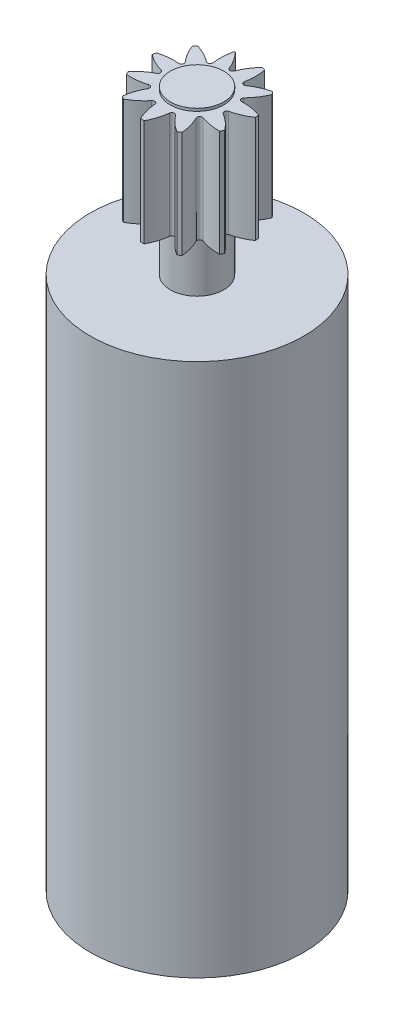
from build123d import *

# Parameters (mm, degrees)
CUT_EXTRUDE_START        = -4.3
CUT_EXTRUDE_1_DEPTH      = 4.3
PATTERN_CIRCULAR_1_COUNT = 11
PATTERN_CIRCULAR_1_ANGLE = 330


with BuildPart() as part:
    # ｽｹｯﾁ1 → 回転1 (revolve)
    with BuildSketch(Plane.XY, mode=Mode.PRIVATE) as revolve_1_sk:
        Polygon((0, 0), (0, 26.1), (1, 26.1), (1, 26), (2, 26), (2, 22), (1, 22), (1, 20), (4, 20), (4, 0), align=None)
    revolve(revolve_1_sk.sketch.rotate(Axis((0, 0, 0), (0, 1, 0)), 90), axis=Axis((0, 0, 0), (0, 1, 0)))

    # ｽｹｯﾁ3 → ｶｯﾄ - 押し出し1 (cut)
    with BuildSketch(Plane(origin=(0, 26, 0), x_dir=(1, 0, 0), z_dir=(0, 1, 0)).offset(CUT_EXTRUDE_START)):
        with BuildLine():
            ThreePointArc((0.092905413, 1.299949383), (0.266119458, 1.637619869), (0.5, 1.936491673))
            ThreePointArc((0.5, 1.936491673), (0, 2), (-0.5, 1.936491673))
            ThreePointArc((-0.5, 1.936491673), (-0.266119458, 1.637619869), (-0.092905413, 1.299949383))
            ThreePointArc((-0.092905413, 1.299949383), (0, 1.236943764), (0.092905413, 1.299949383))
        make_face()
    cut_extrude_1 = extrude(amount=CUT_EXTRUDE_1_DEPTH, mode=Mode.SUBTRACT)

    # 円形ﾊﾟﾀｰﾝ1: ｶｯﾄ - 押し出し1 ×11 about axis
    pattern_circular_1_axis = Axis((0, 0, 0), (0, -1, 0))
    for i in range(1, PATTERN_CIRCULAR_1_COUNT):
        add(cut_extrude_1.rotate(pattern_circular_1_axis, i * PATTERN_CIRCULAR_1_ANGLE / (PATTERN_CIRCULAR_1_COUNT - 1)), mode=Mode.SUBTRACT)


solid = part.part
